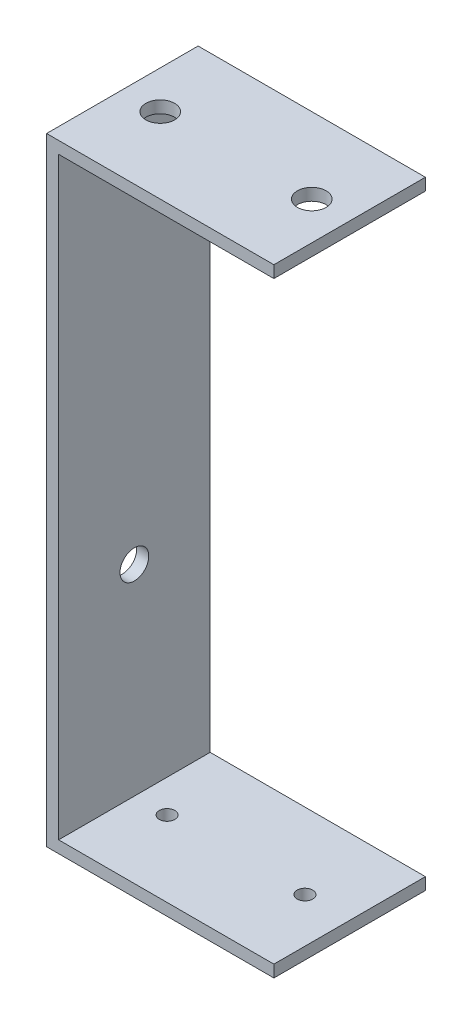
from build123d import *

# Parameters (mm, degrees)
BOSS_EXTRUDE1_DEPTH        = 20
F_6_CLEARANCE_HOLE1_REACH  = 91.156
F_6_CLEARANCE_HOLE1_BORE_R = 1.89865
F_1_CLEARANCE_HOLE1_REACH  = 91.156
F_1_CLEARANCE_HOLE1_BORE_R = 1.0287
F_6_CLEARANCE_HOLE2_D      = 3.7973


with BuildPart() as part:
    # Sketch1 → Boss-Extrude1 (new body)
    with BuildSketch(Plane.XY):
        Polygon((30, 0), (0, 0), (0, 81.54), (30, 81.54), (30, 79.9525), (1.5875, 79.9525), (1.5875, 1.5875), (30, 1.5875), align=None)
    extrude(amount=BOSS_EXTRUDE1_DEPTH)

    # #6 Clearance Hole1 bore → #6 Clearance Hole1 (cut, up to next)
    with BuildSketch(Plane(origin=(0, 81.54, 0), x_dir=(1, 0, 0), z_dir=(0, 1, 0)), mode=Mode.PRIVATE) as f_6_clearance_hole1_sk1:
        with Locations((5, -10)):
            Circle(F_6_CLEARANCE_HOLE1_BORE_R)
    f_6_clearance_hole1_tool1 = extrude(f_6_clearance_hole1_sk1.sketch, amount=-F_6_CLEARANCE_HOLE1_REACH, mode=Mode.PRIVATE) & part.part
    # #6 Clearance Hole1 bore → #6 Clearance Hole1 (cut, up to next)
    with BuildSketch(Plane(origin=(0, 81.54, 0), x_dir=(1, 0, 0), z_dir=(0, 1, 0)), mode=Mode.PRIVATE) as f_6_clearance_hole1_sk2:
        with Locations((25, -10)):
            Circle(F_6_CLEARANCE_HOLE1_BORE_R)
    f_6_clearance_hole1_tool2 = extrude(f_6_clearance_hole1_sk2.sketch, amount=-F_6_CLEARANCE_HOLE1_REACH, mode=Mode.PRIVATE) & part.part
    add(f_6_clearance_hole1_tool1.solids().sort_by_distance((5, 81.54, 10))[0], mode=Mode.SUBTRACT)
    add(f_6_clearance_hole1_tool2.solids().sort_by_distance((25, 81.54, 10))[0], mode=Mode.SUBTRACT)

    # #1 Clearance Hole1 bore → #1 Clearance Hole1 (cut, up to next)
    with BuildSketch(Plane(origin=(0, 0, 0), x_dir=(-1, 0, 0), z_dir=(0, -1, 0)), mode=Mode.PRIVATE) as f_1_clearance_hole1_sk1:
        with Locations((-5.9, -10)):
            Circle(F_1_CLEARANCE_HOLE1_BORE_R)
    f_1_clearance_hole1_tool1 = extrude(f_1_clearance_hole1_sk1.sketch, amount=-F_1_CLEARANCE_HOLE1_REACH, mode=Mode.PRIVATE) & part.part
    # #1 Clearance Hole1 bore → #1 Clearance Hole1 (cut, up to next)
    with BuildSketch(Plane(origin=(0, 0, 0), x_dir=(-1, 0, 0), z_dir=(0, -1, 0)), mode=Mode.PRIVATE) as f_1_clearance_hole1_sk2:
        with Locations((-24.1, -10)):
            Circle(F_1_CLEARANCE_HOLE1_BORE_R)
    f_1_clearance_hole1_tool2 = extrude(f_1_clearance_hole1_sk2.sketch, amount=-F_1_CLEARANCE_HOLE1_REACH, mode=Mode.PRIVATE) & part.part
    add(f_1_clearance_hole1_tool1.solids().sort_by_distance((5.9, 0, 10))[0], mode=Mode.SUBTRACT)
    add(f_1_clearance_hole1_tool2.solids().sort_by_distance((24.1, 0, 10))[0], mode=Mode.SUBTRACT)

    # #6 Clearance Hole2 (through all)
    with Locations(Plane.ZY):
        with Locations((10, 28.08)):
            Hole(F_6_CLEARANCE_HOLE2_D / 2)


solid = part.part
